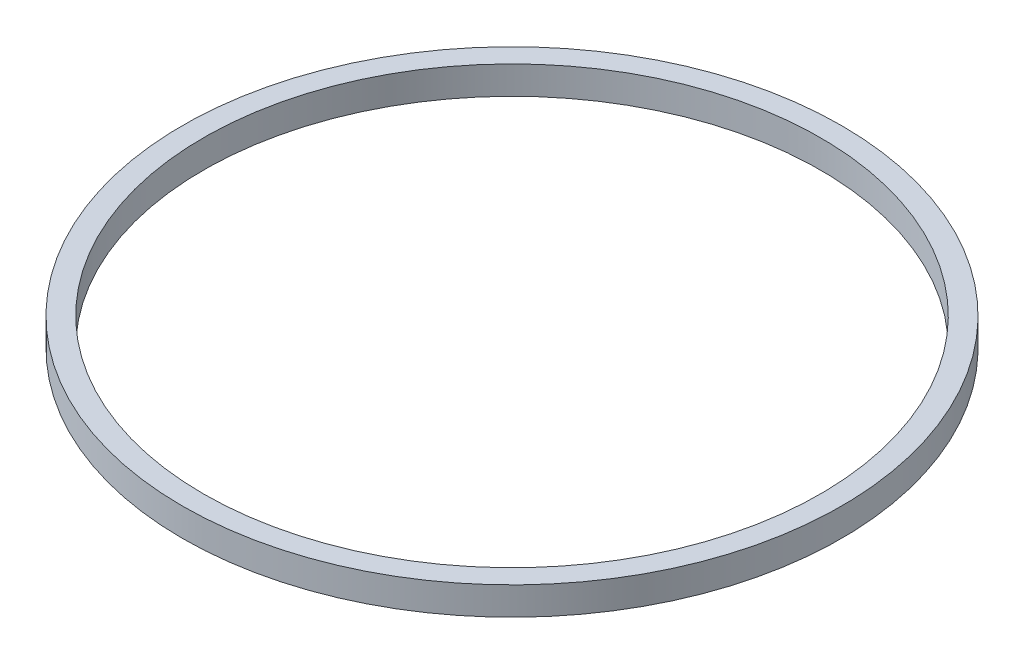
from build123d import *

# Parameters (mm, degrees)
SKETCH1_R           = 11.75
SKETCH1_R_2         = 11
BOSS_EXTRUDE1_DEPTH = 1


with BuildPart() as part:
    # Sketch1 → Boss-Extrude1 (new body)
    with BuildSketch(Plane(origin=(0, 0, 0), x_dir=(1, 0, 0), z_dir=(0, 1, 0))):
        with Locations(Location((0, 0, 0), (0, 0, 270))):
            Circle(SKETCH1_R)
        with Locations(Location((0, 0, 0), (0, 0, 270))):
            Circle(SKETCH1_R_2, mode=Mode.SUBTRACT)
    extrude(amount=BOSS_EXTRUDE1_DEPTH)


solid = part.part
